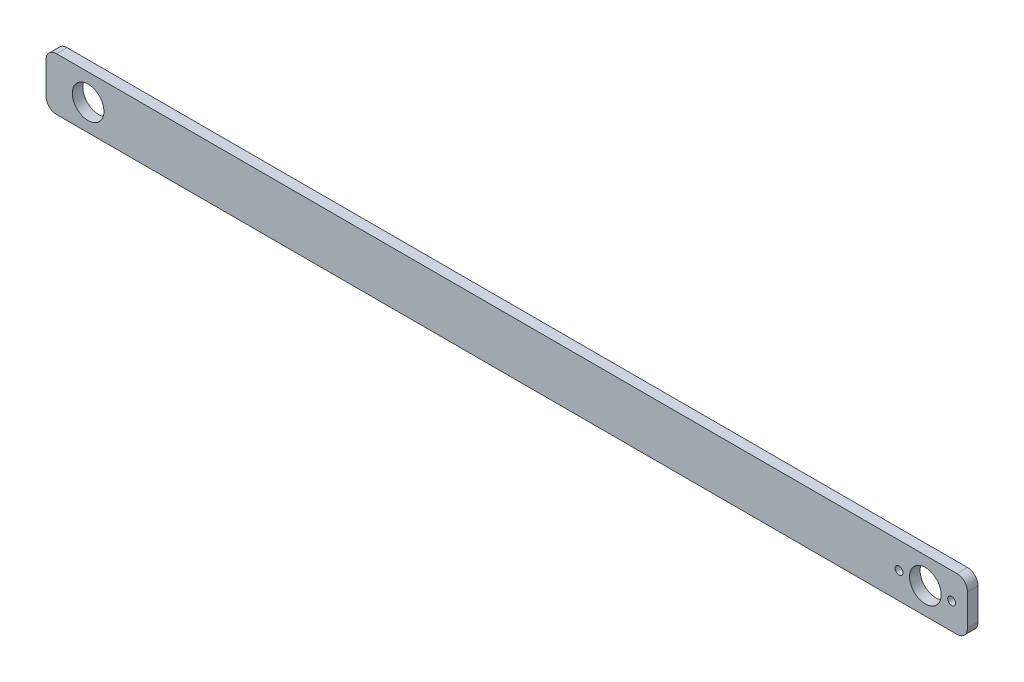
from build123d import *

# Parameters (mm, degrees)
SKETCH_1_W               = 175
SKETCH_1_H               = 10
EXTRUDE_1_DEPTH          = 2
CUT_EXTRUDE_1_DEPTH      = 12
CUT_EXTRUDE_1_DEPTH_BACK = 15
SKETCH_2_R               = 3
SKETCH_3_R               = 3
SKETCH_3_R_2             = 0.75
CUT_EXTRUDE_2_DEPTH      = 10
FILLET_1_R               = 2


with BuildPart() as part:
    # 草图1 → 凸台-拉伸1 (new body)
    with BuildSketch(Plane.XY):
        with Locations((-82.5, -5)):
            Rectangle(SKETCH_1_W, SKETCH_1_H)
    extrude(amount=EXTRUDE_1_DEPTH)

    # 草图2 → 切除-拉伸1 (cut, two sides: drawn at the far end of the back side and taken through both)
    with BuildSketch(Plane.XY.offset(2).offset(-CUT_EXTRUDE_1_DEPTH_BACK)):
        with Locations((-162, -5)):
            Circle(SKETCH_2_R)
    extrude(amount=CUT_EXTRUDE_1_DEPTH + CUT_EXTRUDE_1_DEPTH_BACK, mode=Mode.SUBTRACT)

    # 草图3 → 切除-拉伸2 (cut)
    with BuildSketch(Plane.XY.offset(2)):
        with Locations((-3, -5)):
            Circle(SKETCH_3_R)
        with Locations((-8, -5)):
            Circle(SKETCH_3_R_2)
        with Locations((2, -5)):
            Circle(SKETCH_3_R_2)
    extrude(amount=-CUT_EXTRUDE_2_DEPTH, mode=Mode.SUBTRACT)

    # 圆角1
    fillet_1_edges = [part.edges().sort_by_distance(p)[0] for p in [
        (-170, 0, 1),
        (5, 0, 1),
        (5, -10, 1),
        (-170, -10, 1),
    ]]
    fillet(fillet_1_edges, radius=FILLET_1_R)


solid = part.part
